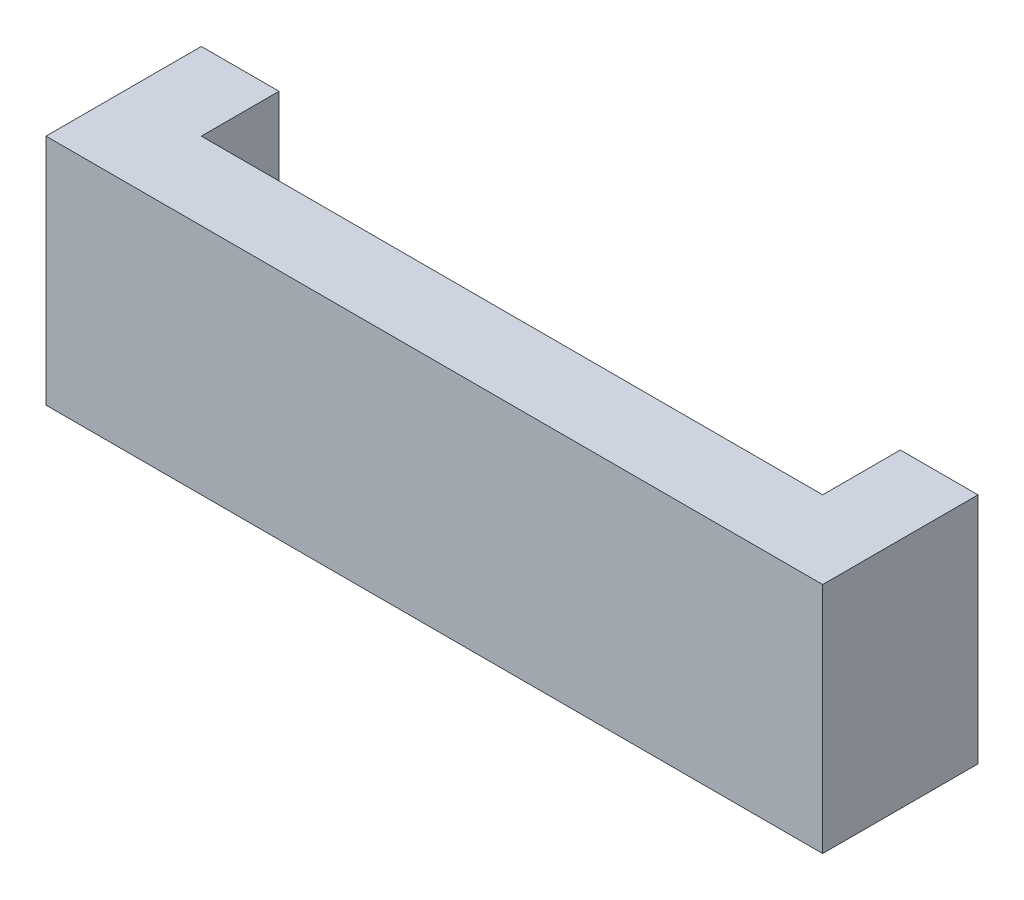
from build123d import *

# Parameters (mm, degrees)
BOSS_EXTRUDE1_DEPTH = 30


with BuildPart() as part:
    # Sketch1 → Boss-Extrude1 (new body)
    with BuildSketch(Plane(origin=(0, 0, 0), x_dir=(1, 0, 0), z_dir=(0, 1, 0))):
        Polygon((-50, 0), (-40, 0), (-40, -10), (40, -10), (40, 0), (50, 0), (50, -20), (-50, -20), align=None)
    extrude(amount=BOSS_EXTRUDE1_DEPTH)


solid = part.part
